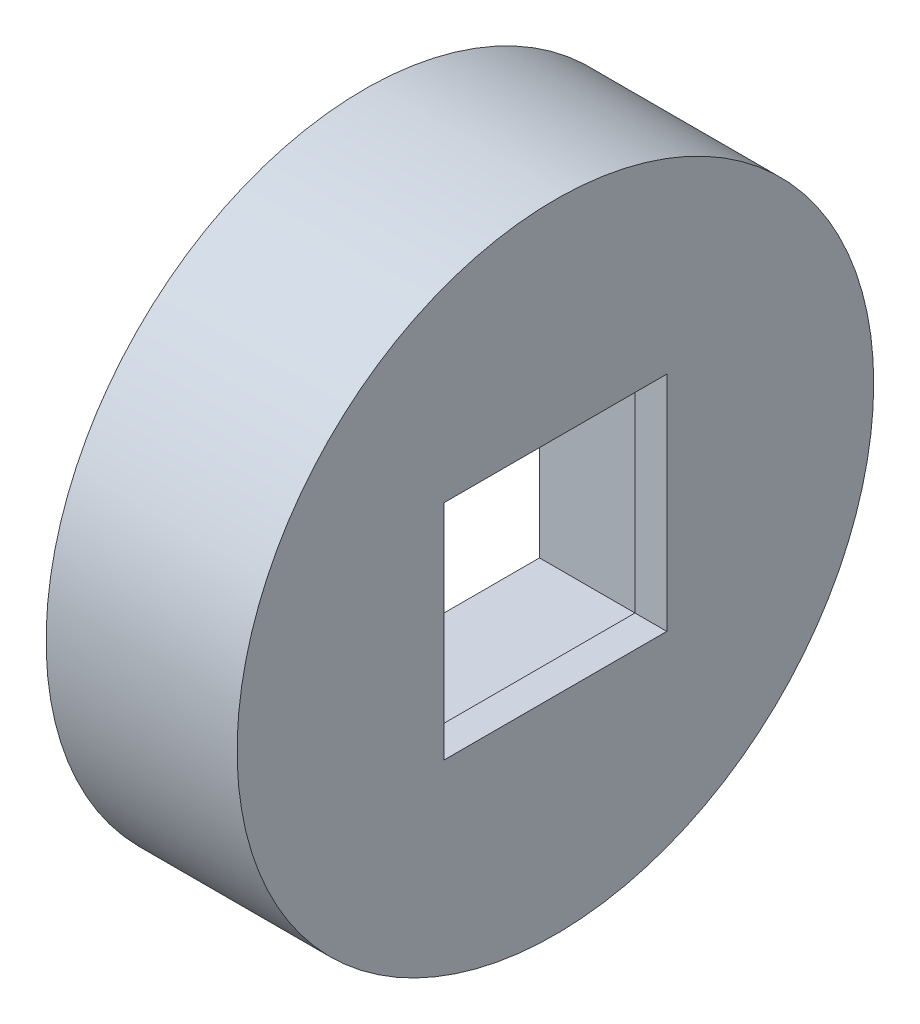
from build123d import *

# Parameters (mm, degrees)
SKETCH_1_R      = 5
SKETCH_1_W      = 5.5
SKETCH_1_H      = 5.5
EXTRUDE_1_DEPTH = 2.5
SKETCH_3_R      = 5
SKETCH_3_W      = 3.5
SKETCH_3_H      = 3.5
EXTRUDE_3_DEPTH = 0.5


with BuildPart() as part:
    # 草图1 → 凸台-拉伸1 (new body)
    with BuildSketch(Plane(origin=(0, 0, 0), x_dir=(0, 0, -1), z_dir=(1, 0, 0))):
        Circle(SKETCH_1_R)
        Rectangle(SKETCH_1_W, SKETCH_1_H, mode=Mode.SUBTRACT)
    extrude(amount=EXTRUDE_1_DEPTH)

    # 草图3 → 凸台-拉伸3 (add)
    with BuildSketch(Plane(origin=(2.5, 0, 0), x_dir=(0, 0, -1), z_dir=(1, 0, 0))):
        Circle(SKETCH_3_R)
        Rectangle(SKETCH_3_W, SKETCH_3_H, mode=Mode.SUBTRACT)
    extrude(amount=EXTRUDE_3_DEPTH)


solid = part.part
